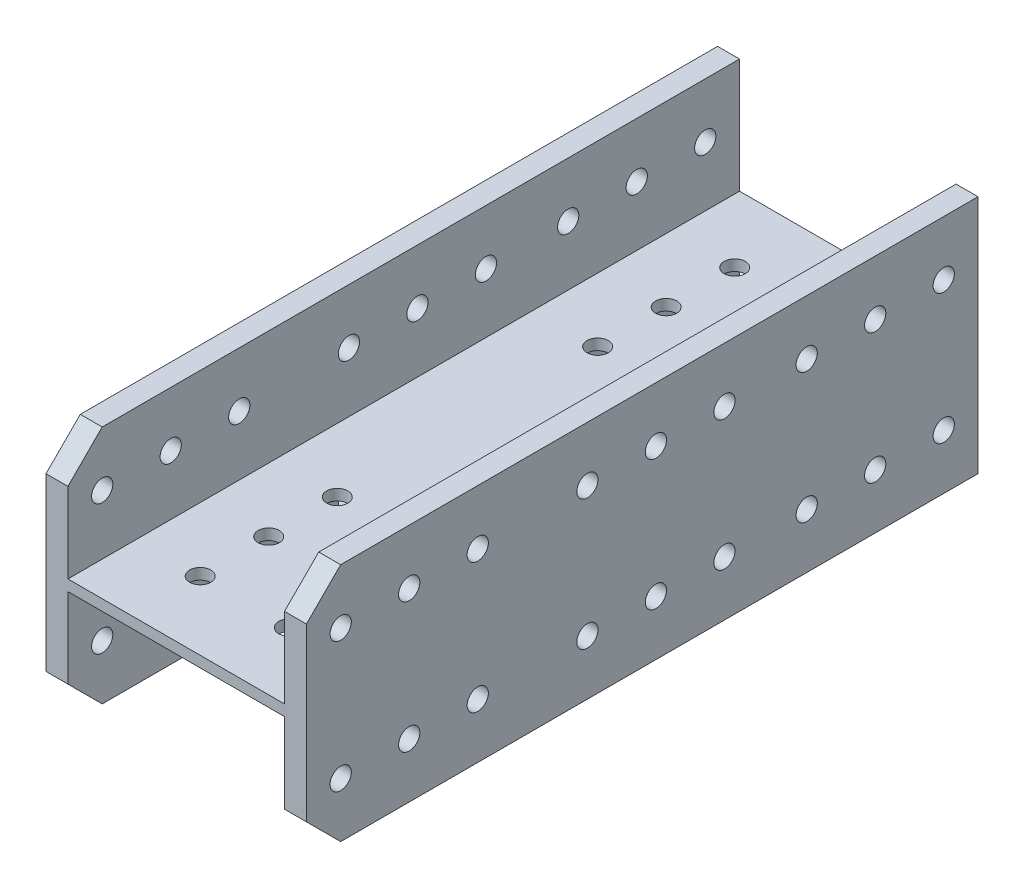
from build123d import *

# Parameters (mm, degrees)
EXTRUDE_1_DEPTH     = 980
SKETCH_2_R          = 15.5
CUT_EXTRUDE_2_DEPTH = 1066.563231348
SKETCH_3_R          = 15.5
CUT_EXTRUDE_3_DEPTH = 1015.883737184
CUT_EXTRUDE_4_DEPTH = 1066.563231348


with BuildPart() as part:
    # 草图1 → 拉伸1 (new body)
    with BuildSketch(Plane.XY):
        Polygon((-158, 175), (-190, 175), (-190, -175), (-158, -175), (-158, -8), (158, -8), (158, -175), (190, -175), (190, 175), (158, 175), (158, 8), (-158, 8), align=None)
    extrude(amount=EXTRUDE_1_DEPTH)

    # 草图2 → 拉伸2 (cut, through all)
    with BuildSketch(Plane(origin=(190, 0, 0), x_dir=(0, 0, -1), z_dir=(1, 0, 0))):
        with Locations(Location((-930, 95, 0), (0, 0, 90))):
            Circle(SKETCH_2_R)
        with Locations(Location((-830, 95, 0), (0, 0, 90))):
            Circle(SKETCH_2_R)
        with Locations(Location((-730, 95, 0), (0, 0, 90))):
            Circle(SKETCH_2_R)
        with Locations(Location((-930, -95, 0), (0, 0, 90))):
            Circle(SKETCH_2_R)
        with Locations(Location((-830, -95, 0), (0, 0, 90))):
            Circle(SKETCH_2_R)
        with Locations(Location((-730, -95, 0), (0, 0, 90))):
            Circle(SKETCH_2_R)
        with Locations(Location((-570, 95, 0), (0, 0, 90))):
            Circle(SKETCH_2_R)
        with Locations(Location((-470, 95, 0), (0, 0, 90))):
            Circle(SKETCH_2_R)
        with Locations(Location((-370, 95, 0), (0, 0, 90))):
            Circle(SKETCH_2_R)
        with Locations(Location((-370, -95, 0), (0, 0, 90))):
            Circle(SKETCH_2_R)
        with Locations(Location((-470, -95, 0), (0, 0, 90))):
            Circle(SKETCH_2_R)
        with Locations(Location((-570, -95, 0), (0, 0, 90))):
            Circle(SKETCH_2_R)
        with Locations(Location((-50, 95, 0), (0, 0, 90))):
            Circle(SKETCH_2_R)
        with Locations(Location((-150, 95, 0), (0, 0, 90))):
            Circle(SKETCH_2_R)
        with Locations(Location((-250, 95, 0), (0, 0, 90))):
            Circle(SKETCH_2_R)
        with Locations(Location((-250, -95, 0), (0, 0, 90))):
            Circle(SKETCH_2_R)
        with Locations(Location((-150, -95, 0), (0, 0, 90))):
            Circle(SKETCH_2_R)
        with Locations(Location((-50, -95, 0), (0, 0, 90))):
            Circle(SKETCH_2_R)
    extrude(amount=-CUT_EXTRUDE_2_DEPTH, mode=Mode.SUBTRACT)

    # 草图3 → 拉伸3 (cut, through all)
    with BuildSketch(Plane(origin=(0, 8, 0), x_dir=(1, 0, 0), z_dir=(0, 1, 0))):
        with Locations(Location((65, -100, 0), (0, 0, 270))):
            Circle(SKETCH_3_R)
        with Locations(Location((-65, -100, 0), (0, 0, 270))):
            Circle(SKETCH_3_R)
        with Locations(Location((65, -200, 0), (0, 0, 270))):
            Circle(SKETCH_3_R)
        with Locations(Location((-65, -200, 0), (0, 0, 270))):
            Circle(SKETCH_3_R)
        with Locations(Location((65, -300, 0), (0, 0, 270))):
            Circle(SKETCH_3_R)
        with Locations(Location((-65, -300, 0), (0, 0, 270))):
            Circle(SKETCH_3_R)
        with Locations(Location((-65, -680, 0), (0, 0, 270))):
            Circle(SKETCH_3_R)
        with Locations(Location((-65, -780, 0), (0, 0, 270))):
            Circle(SKETCH_3_R)
        with Locations(Location((65, -780, 0), (0, 0, 270))):
            Circle(SKETCH_3_R)
        with Locations(Location((65, -880, 0), (0, 0, 270))):
            Circle(SKETCH_3_R)
        with Locations(Location((-65, -880, 0), (0, 0, 270))):
            Circle(SKETCH_3_R)
        with Locations(Location((65, -680, 0), (0, 0, 270))):
            Circle(SKETCH_3_R)
    extrude(amount=-CUT_EXTRUDE_3_DEPTH, mode=Mode.SUBTRACT)

    # 草图4 → 拉伸4 (cut, through all)
    with BuildSketch(Plane(origin=(190, 0, 0), x_dir=(0, 0, -1), z_dir=(1, 0, 0))):
        Polygon((-930, 175), (-980, 125), (-980, 175), align=None)
        Polygon((-980, -125), (-930, -175), (-980, -175), align=None)
    extrude(amount=-CUT_EXTRUDE_4_DEPTH, mode=Mode.SUBTRACT)


solid = part.part
